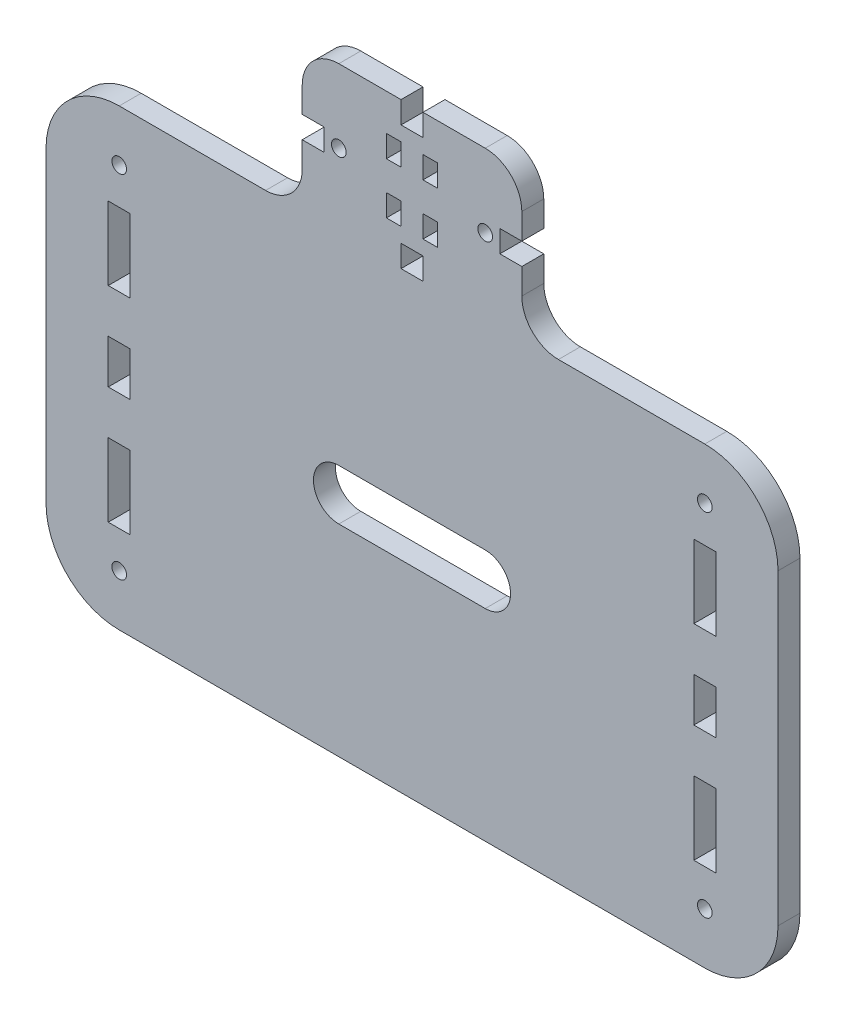
from build123d import *

# Parameters (mm, degrees)
ESQUISSE1_R             = 5
ESQUISSE1_W             = 15
ESQUISSE1_H             = 30
ESQUISSE1_H_2           = 50
BOSS_EXTRU_1_DEPTH      = 15
ESQUISSE2_R             = 5
ESQUISSE2_W             = 34.887872932
ESQUISSE2_H             = 15
ESQUISSE2_W_2           = 15
ESQUISSE2_W_3           = 10
ENL_V_MAT_EXTRU_1_DEPTH = 358.421320013


with BuildPart() as part:
    # Esquisse1 → Boss.-Extru.1 (new body)
    with BuildSketch(Plane.XY):
        with BuildLine():
            Line((-200, -155), (200, -155))
            ThreePointArc((200, -155), (235.355339059, -140.355339059), (250, -105))
            Line((250, -105), (250, 105))
            ThreePointArc((250, 105), (235.355339059, 140.355339059), (200, 155))
            Line((200, 155), (100, 155))
            ThreePointArc((100, 155), (82.32233047, 162.32233047), (75, 180))
            Line((75, 180), (75, 230))
            ThreePointArc((75, 230), (67.67766953, 247.67766953), (50, 255))
            Line((50, 255), (-50, 255))
            ThreePointArc((-50, 255), (-67.67766953, 247.67766953), (-75, 230))
            Line((-75, 230), (-75, 180))
            ThreePointArc((-75, 180), (-82.32233047, 162.32233047), (-100, 155))
            Line((-100, 155), (-200, 155))
            ThreePointArc((-200, 155), (-235.355339059, 140.355339059), (-250, 105))
            Line((-250, 105), (-250, -105))
            ThreePointArc((-250, -105), (-235.355339059, -140.355339059), (-200, -155))
        make_face()
        with Locations((200, 120)):
            Circle(ESQUISSE1_R, mode=Mode.SUBTRACT)
        with Locations(Location((200, -120, 0), (0, 0, 180))):
            Circle(ESQUISSE1_R, mode=Mode.SUBTRACT)
        with Locations((-200, -120)):
            Circle(ESQUISSE1_R, mode=Mode.SUBTRACT)
        with Locations(Location((-200, 120, 0), (0, 0, 180))):
            Circle(ESQUISSE1_R, mode=Mode.SUBTRACT)
        with Locations((200, 0)):
            Rectangle(ESQUISSE1_W, ESQUISSE1_H, mode=Mode.SUBTRACT)
        with Locations((200, 70)):
            Rectangle(ESQUISSE1_W, ESQUISSE1_H_2, mode=Mode.SUBTRACT)
        with Locations((200, -70)):
            Rectangle(ESQUISSE1_W, ESQUISSE1_H_2, mode=Mode.SUBTRACT)
        with Locations((-200, -70)):
            Rectangle(ESQUISSE1_W, ESQUISSE1_H_2, mode=Mode.SUBTRACT)
        with Locations((-200, 0)):
            Rectangle(ESQUISSE1_W, ESQUISSE1_H, mode=Mode.SUBTRACT)
        with Locations((-200, 70)):
            Rectangle(ESQUISSE1_W, ESQUISSE1_H_2, mode=Mode.SUBTRACT)
        with BuildLine():
            Line((50, -17.321312087), (-50, -17.321312087))
            ThreePointArc((-50, -17.321312087), (-67.321312087, 0), (-50, 17.321312087))
            Line((-50, 17.321312087), (50, 17.321312087))
            ThreePointArc((50, 17.321312087), (67.321312087, 0), (50, -17.321312087))
        make_face(mode=Mode.SUBTRACT)
    extrude(amount=BOSS_EXTRU_1_DEPTH)

    # Esquisse2 → Enlèv. mat.-Extru.1 (cut, through all)
    with BuildSketch(Plane.XY.offset(15)):
        with Locations((50, 205)):
            Circle(ESQUISSE2_R)
        with Locations(Location((-50, 205, 0), (0, 0, 180))):
            Circle(ESQUISSE2_R)
        with Locations((77.443936466, 205)):
            Rectangle(ESQUISSE2_W, ESQUISSE2_H)
        with Locations((0, 247.5)):
            Rectangle(ESQUISSE2_W_2, ESQUISSE2_H)
        with Locations((-77.443936466, 205)):
            Rectangle(ESQUISSE2_W, ESQUISSE2_H)
        with Locations((0, 162.5)):
            Rectangle(ESQUISSE2_W_2, ESQUISSE2_H)
        with Locations((12.5, 222.5)):
            Rectangle(ESQUISSE2_W_3, ESQUISSE2_H)
        with Locations((-12.5, 222.5)):
            Rectangle(ESQUISSE2_W_3, ESQUISSE2_H)
        with Locations((12.5, 187.5)):
            Rectangle(ESQUISSE2_W_3, ESQUISSE2_H)
        with Locations((-12.5, 187.5)):
            Rectangle(ESQUISSE2_W_3, ESQUISSE2_H)
    extrude(amount=-ENL_V_MAT_EXTRU_1_DEPTH, mode=Mode.SUBTRACT)


solid = part.part
